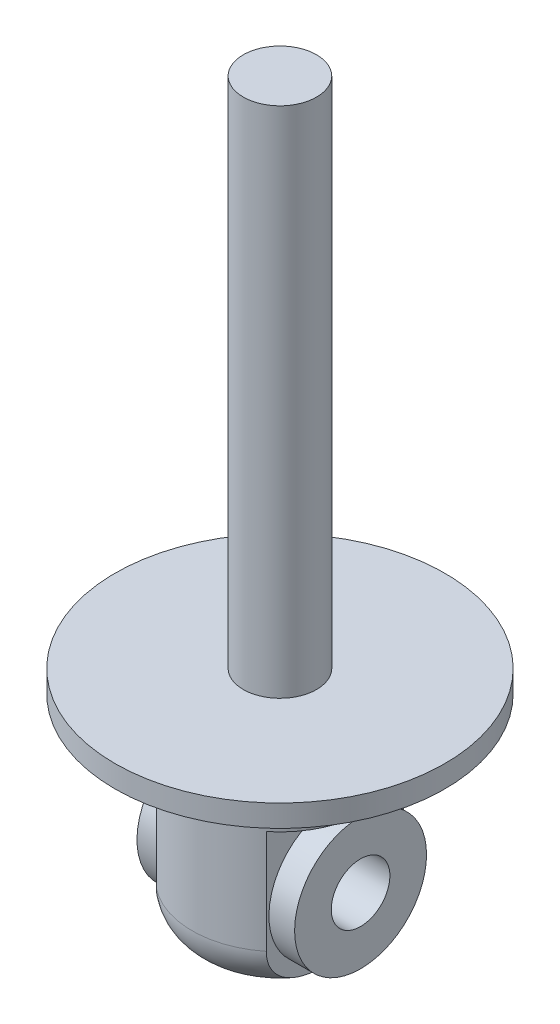
from build123d import *

# Parameters (mm, degrees)
SKETCH1_R               = 22.5
BOSS_EXTRUDE1_DEPTH     = 3
SKETCH2_R               = 5
BOSS_EXTRUDE2_DEPTH     = 70
SKETCH3_R               = 12
BOSS_EXTRUDE3_DEPTH     = 28
FILLET1_R               = 6
CUT_EXTRUDE1_DEPTH      = 80.633535649
CUT_EXTRUDE1_DEPTH_BACK = 80.633535649
SKETCH4_W               = 15.997747603
SKETCH4_H               = 20
SKETCH5_R               = 4
CUT_EXTRUDE2_DEPTH      = 83.068568892
SKETCH6_R               = 9
SKETCH6_R_2             = 4
BOSS_EXTRUDE15_DEPTH    = 3.5
SKETCH10_R              = 9
SKETCH10_R_2            = 4
BOSS_EXTRUDE19_DEPTH    = 3


with BuildPart() as part:
    # Sketch1 → Boss-Extrude1 (new body)
    with BuildSketch(Plane(origin=(0, 0, 0), x_dir=(1, 0, 0), z_dir=(0, 1, 0))):
        with Locations(Location((0, 0, 0), (0, 0, 270))):
            Circle(SKETCH1_R)
    extrude(amount=BOSS_EXTRUDE1_DEPTH)

    # Sketch2 → Boss-Extrude2 (add)
    with BuildSketch(Plane(origin=(0, 3, 0), x_dir=(1, 0, 0), z_dir=(0, 1, 0))):
        with Locations(Location((0, 0, 0), (0, 0, 270))):
            Circle(SKETCH2_R)
    extrude(amount=BOSS_EXTRUDE2_DEPTH)

    # Sketch3 → Boss-Extrude3 (add)
    with BuildSketch(Plane.XZ):
        with Locations(Location((0, 0, 0), (0, 0, 270))):
            Circle(SKETCH3_R)
    extrude(amount=BOSS_EXTRUDE3_DEPTH)

    # Fillet1
    fillet1_edges = [part.edges().sort_by_distance(p)[0] for p in [
        (0, -28, 12),
    ]]
    fillet(fillet1_edges, radius=FILLET1_R)

    # Sketch4 → Cut-Extrude1 (cut, two sides: drawn at the far end of the back side and taken through both)
    with BuildSketch(Plane.XY.offset(-CUT_EXTRUDE1_DEPTH_BACK)):
        with Locations((-15.498873802, -17.840930737)):
            Rectangle(SKETCH4_W, SKETCH4_H)
        with Locations((15.498873802, -17.840930737)):
            Rectangle(SKETCH4_W, SKETCH4_H)
    extrude(amount=CUT_EXTRUDE1_DEPTH + CUT_EXTRUDE1_DEPTH_BACK, mode=Mode.SUBTRACT)

    # Sketch5 → Cut-Extrude2 (cut, through all)
    with BuildSketch(Plane(origin=(7.5, 0, 0), x_dir=(0, 0, -1), z_dir=(1, 0, 0))):
        with Locations(Location((0, -18, 0), (0, 0, 90))):
            Circle(SKETCH5_R)
    extrude(amount=-CUT_EXTRUDE2_DEPTH, mode=Mode.SUBTRACT)

    # Sketch6 → Boss-Extrude15 (add, symmetric)
    with BuildSketch(Plane(origin=(7.5, 0, 0), x_dir=(0, 0, -1), z_dir=(1, 0, 0))):
        with Locations(Location((0, -18, 0), (0, 0, 270))):
            Circle(SKETCH6_R)
        with Locations(Location((0, -18, 0), (0, 0, 90))):
            Circle(SKETCH6_R_2, mode=Mode.SUBTRACT)
    extrude(amount=BOSS_EXTRUDE15_DEPTH, both=True)

    # Sketch10 → Boss-Extrude19 (add)
    with BuildSketch(Plane.ZY.offset(7.5)):
        with Locations(Location((0, -18, 0), (0, 0, 270))):
            Circle(SKETCH10_R)
        with Locations(Location((0, -18, 0), (0, 0, 90))):
            Circle(SKETCH10_R_2, mode=Mode.SUBTRACT)
    extrude(amount=BOSS_EXTRUDE19_DEPTH)


solid = part.part
